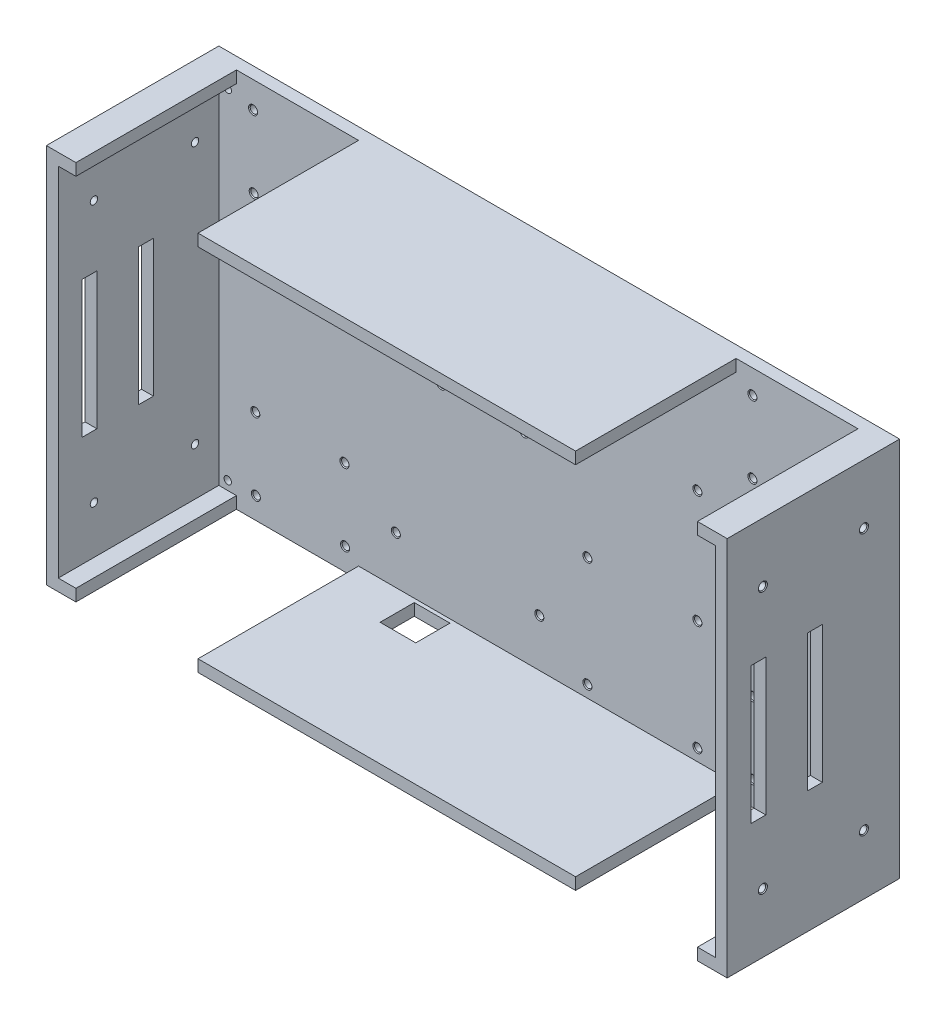
from build123d import *

# Parameters (mm, degrees)
SKETCH_4_W                   = 229
SKETCH_4_H                   = 128
EXTRUDE_2_DEPTH              = 58
CUT_EXTRUDE_START            = 4
SKETCH_6_W                   = 221
SKETCH_6_H                   = 120
CUT_EXTRUDE_2_DEPTH          = 58
HOLE_WIZARD_M3_5_D           = 2.5
HOLE_WIZARD_M3_5_DEPTH       = 4
HOLE_WIZARD_M3_5_CSINK_D     = 3.05
HOLE_WIZARD_M3_5_CSINK_ANGLE = 90
HOLE_WIZARD_M3_3_D           = 2.5
HOLE_WIZARD_M3_3_CSINK_D     = 3.05
HOLE_WIZARD_M3_3_CSINK_ANGLE = 90
SKETCH_23_W                  = 5
SKETCH_23_H                  = 46
CUT_EXTRUDE_3_DEPTH          = 253.465633094
SKETCH_24_W                  = 41.070947304
SKETCH_24_H                  = 54
SKETCH_24_W_2                = 41
CUT_EXTRUDE_4_DEPTH          = 184.369425463
HOLE_WIZARD_M3_6_D           = 2.5
HOLE_WIZARD_M3_6_CSINK_D     = 3.05
HOLE_WIZARD_M3_6_CSINK_ANGLE = 90
HOLE_WIZARD_M3_7_D           = 2.5
HOLE_WIZARD_M3_7_CSINK_D     = 3.05
HOLE_WIZARD_M3_7_CSINK_ANGLE = 90
HOLE_WIZARD_M3_8_D           = 2.5
HOLE_WIZARD_M3_8_CSINK_D     = 3.05
HOLE_WIZARD_M3_8_CSINK_ANGLE = 90
HOLE_WIZARD_M3_9_D           = 2.5
HOLE_WIZARD_M3_9_CSINK_D     = 3.05
HOLE_WIZARD_M3_9_CSINK_ANGLE = 90
SKETCH_40_W                  = 5
SKETCH_40_H                  = 46
CUT_EXTRUDE_5_DEPTH          = 253.465633094
SKETCH_43_W                  = 12
SKETCH_43_H                  = 11.5
CUT_EXTRUDE_8_DEPTH          = 10.5


with BuildPart() as part:
    # 草图4 → 凸台-拉伸2 (new body)
    with BuildSketch(Plane.XY):
        with Locations((-3.297904033, 25.072419375)):
            Rectangle(SKETCH_4_W, SKETCH_4_H)
    extrude(amount=EXTRUDE_2_DEPTH)

    # 草图6 → 切除-拉伸2 (cut)
    with BuildSketch(Plane.XY.offset(CUT_EXTRUDE_START)):
        with Locations((-3.297904033, 25.072419375)):
            Rectangle(SKETCH_6_W, SKETCH_6_H)
    extrude(amount=CUT_EXTRUDE_2_DEPTH, mode=Mode.SUBTRACT)

    # M3 螺纹孔5
    with Locations(Plane(origin=(111.202095967, 0, 0), x_dir=(0, 0, -1), z_dir=(1, 0, 0))):
        with Locations((-46, 69.072419375), (-12, 69.072419375), (-12, -18.927580625), (-46, -18.927580625)):
            CounterSinkHole(HOLE_WIZARD_M3_5_D / 2, HOLE_WIZARD_M3_5_CSINK_D / 2, depth=HOLE_WIZARD_M3_5_DEPTH, counter_sink_angle=HOLE_WIZARD_M3_5_CSINK_ANGLE)

    # M3 螺纹孔3 (through all)
    with Locations(Plane(origin=(-117.797904033, 69.072419375, 12), x_dir=(0, 0, -1), z_dir=(-1, 0, 0))):
        with Locations((0, 0), (-34, 0), (-34, 88), (0, 88)):
            CounterSinkHole(HOLE_WIZARD_M3_3_D / 2, HOLE_WIZARD_M3_3_CSINK_D / 2, counter_sink_angle=HOLE_WIZARD_M3_3_CSINK_ANGLE)

    # 草图23 → 切除-拉伸3 (cut, through all)
    with BuildSketch(Plane.ZY.offset(117.797904033)):
        with Locations((47.5, 25.072419375)):
            Rectangle(SKETCH_23_W, SKETCH_23_H)
    extrude(amount=-CUT_EXTRUDE_3_DEPTH, mode=Mode.SUBTRACT)

    # 草图24 → 切除-拉伸4 (cut, through all)
    with BuildSketch(Plane.XZ.offset(38.927580625)):
        with Locations((-87.333377685, 31)):
            Rectangle(SKETCH_24_W, SKETCH_24_H)
        with Locations((80.702095967, 31)):
            Rectangle(SKETCH_24_W_2, SKETCH_24_H)
    extrude(amount=-CUT_EXTRUDE_4_DEPTH, mode=Mode.SUBTRACT)

    # M3 螺纹孔6 (through all)
    with Locations(Plane(origin=(0, 0, 0), x_dir=(-1, 0, 0), z_dir=(0, 0, -1))):
        with Locations((-104.202095967, 82.072419375), (-104.202095967, -31.927580625), (110.797904033, -31.927580625), (110.797904033, 82.072419375)):
            CounterSinkHole(HOLE_WIZARD_M3_6_D / 2, HOLE_WIZARD_M3_6_CSINK_D / 2, counter_sink_angle=HOLE_WIZARD_M3_6_CSINK_ANGLE)

    # M3 螺纹孔7 (through all)
    with Locations(Plane.XY.offset(4)):
        with Locations((-5.997904033, -18.927580625), (-11.077904033, 31.872419375), (-39.017904033, 31.872419375), (-54.257904033, -18.927580625)):
            CounterSinkHole(HOLE_WIZARD_M3_7_D / 2, HOLE_WIZARD_M3_7_CSINK_D / 2, counter_sink_angle=HOLE_WIZARD_M3_7_CSINK_ANGLE)

    # M3 螺纹孔8 (through all)
    with Locations(Plane.XY.offset(4)):
        with Locations((10.202095967, 44.072419375), (10.202095967, 81.072419375), (47.202095967, 81.072419375), (47.202095967, 44.072419375), (47.202095967, 6.072419375), (47.202095967, -30.927580625), (10.202095967, -30.927580625), (10.202095967, 6.072419375)):
            CounterSinkHole(HOLE_WIZARD_M3_8_D / 2, HOLE_WIZARD_M3_8_CSINK_D / 2, counter_sink_angle=HOLE_WIZARD_M3_8_CSINK_ANGLE)

    # M3 螺纹孔9 (through all)
    with Locations(Plane.XY.offset(4)):
        with Locations((-102.260717179, 80.197574321), (-102.059054013, 55.998414584), (-72.060095662, 56.248410244), (-72.261758827, 80.44756998), (65.702095967, 81.022419375), (95.702095967, 81.022419375), (95.702095967, 56.822419375), (65.702095967, 56.822419375), (65.702095967, -6.677580625), (95.702095967, -6.677580625), (95.702095967, -30.877580625), (65.702095967, -30.877580625), (-71.329275016, -31.44854467), (-71.530938182, -7.249384934), (-101.529896533, -7.499380593), (-101.328233368, -31.69854033)):
            CounterSinkHole(HOLE_WIZARD_M3_9_D / 2, HOLE_WIZARD_M3_9_CSINK_D / 2, counter_sink_angle=HOLE_WIZARD_M3_9_CSINK_ANGLE)

    # 草图40 → 切除-拉伸5 (cut, through all)
    with BuildSketch(Plane.ZY.offset(117.797904033)):
        with Locations((28.5, 25.072419375)):
            Rectangle(SKETCH_40_W, SKETCH_40_H)
    extrude(amount=-CUT_EXTRUDE_5_DEPTH, mode=Mode.SUBTRACT)

    # 草图43 → 切除-拉伸8 (cut)
    with BuildSketch(Plane.XZ.offset(38.927580625)):
        with Locations((-40.797904033, 11)):
            Rectangle(SKETCH_43_W, SKETCH_43_H)
    extrude(amount=-CUT_EXTRUDE_8_DEPTH, mode=Mode.SUBTRACT)


solid = part.part
